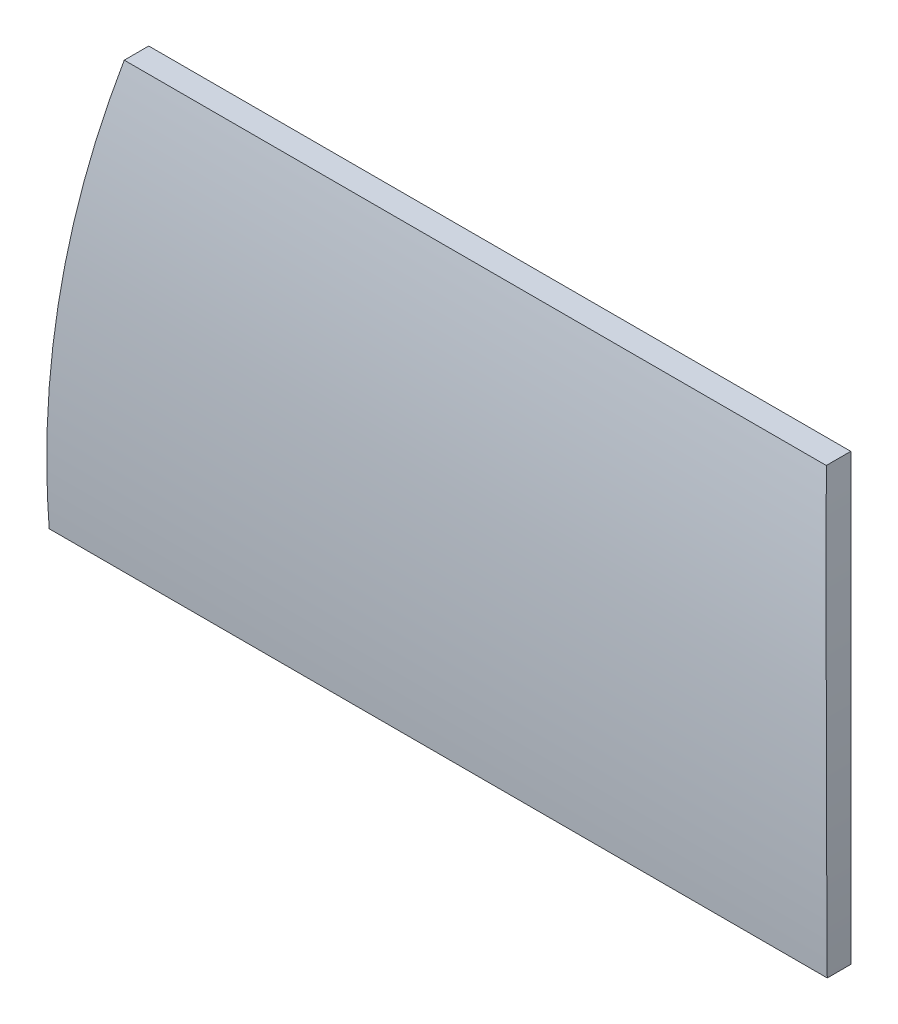
from build123d import *

# Parameters (mm, degrees)
BOSS_EXTRUDE1_DEPTH     = 254
CUT_EXTRUDE1_DEPTH      = 2813.794713328
CUT_EXTRUDE1_DEPTH_BACK = 2813.794713328


with BuildPart() as part:
    # Sketch1 → Boss-Extrude1 (new, symmetric)
    with BuildSketch(Plane.XY):
        with BuildLine():
            Line((121.1841308, 1295.4), (2359.322916218, 1295.4))
            ThreePointArc((2359.322916218, 1295.4), (2461.87817047, 651.62563885), (2480.507047018, 0))
            Line((2480.507047018, 0), (0, 0))
            ThreePointArc((0, 0), (18.628876548, 651.62563885), (121.1841308, 1295.4))
        make_face()
    extrude(amount=BOSS_EXTRUDE1_DEPTH, both=True)

    # Sketch2 → Cut-Extrude1 (cut, two sides: drawn at the far end of the back side and taken through both)
    with BuildSketch(Plane(origin=(0, 0, 0), x_dir=(0, 0, -1), z_dir=(1, 0, 0)).offset(-CUT_EXTRUDE1_DEPTH_BACK)):
        with BuildLine():
            ThreePointArc((118.0703125, 1295.4), (15.664285855, 651.653074125), (0, 0))
            Line((0, 0), (-254, 0))
            Line((-254, 0), (-254, 1295.4))
            Line((-254, 1295.4), (118.0703125, 1295.4))
        make_face()
        with BuildLine():
            Line((196.186778864, 1295.4), (254, 1295.4))
            Line((254, 1295.4), (254, 0))
            Line((254, 0), (76.26716522, 0))
            ThreePointArc((76.26716522, 0), (93.965970842, 651.612245589), (196.186778864, 1295.4))
        make_face()
    extrude(amount=CUT_EXTRUDE1_DEPTH + CUT_EXTRUDE1_DEPTH_BACK, mode=Mode.SUBTRACT)


solid = part.part
